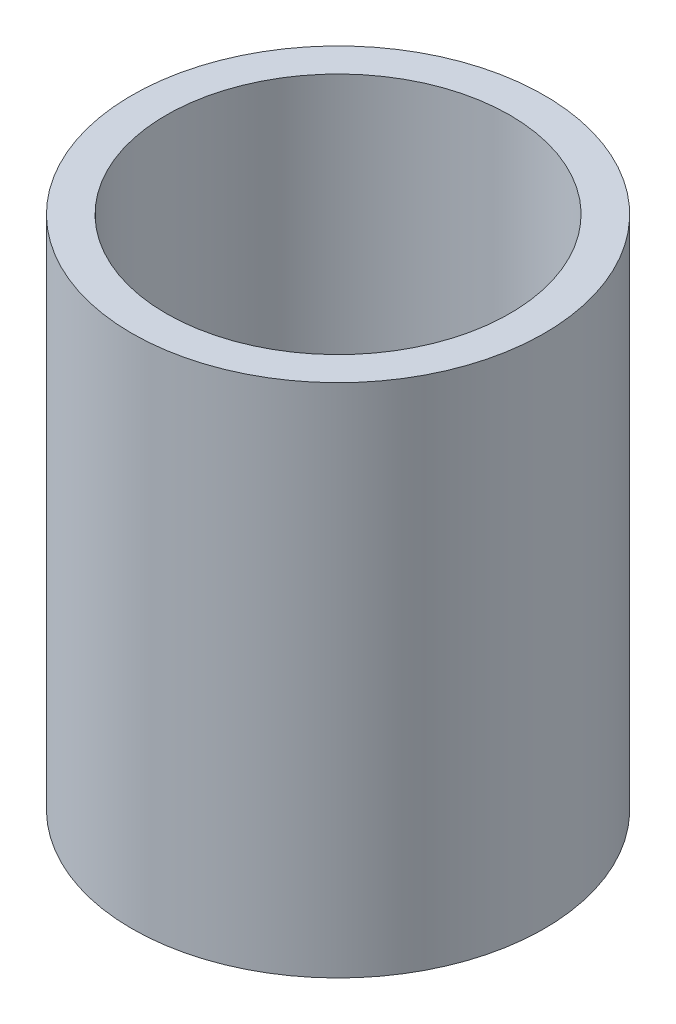
from build123d import *

# Parameters (mm, degrees)
SKETCH1_R           = 60
BOSS_EXTRUDE1_DEPTH = 150
SKETCH2_R           = 50
CUT_EXTRUDE1_DEPTH  = 130


with BuildPart() as part:
    # Sketch1 → Boss-Extrude1 (new body)
    with BuildSketch(Plane(origin=(0, 0, 0), x_dir=(1, 0, 0), z_dir=(0, 1, 0))):
        with Locations(Location((0, 0, 0), (0, 0, 270))):
            Circle(SKETCH1_R)
    extrude(amount=BOSS_EXTRUDE1_DEPTH)

    # Sketch2 → Cut-Extrude1 (cut)
    with BuildSketch(Plane(origin=(0, 150, 0), x_dir=(1, 0, 0), z_dir=(0, 1, 0))):
        with Locations(Location((0, 0, 0), (0, 0, 270))):
            Circle(SKETCH2_R)
    extrude(amount=-CUT_EXTRUDE1_DEPTH, mode=Mode.SUBTRACT)


solid = part.part
